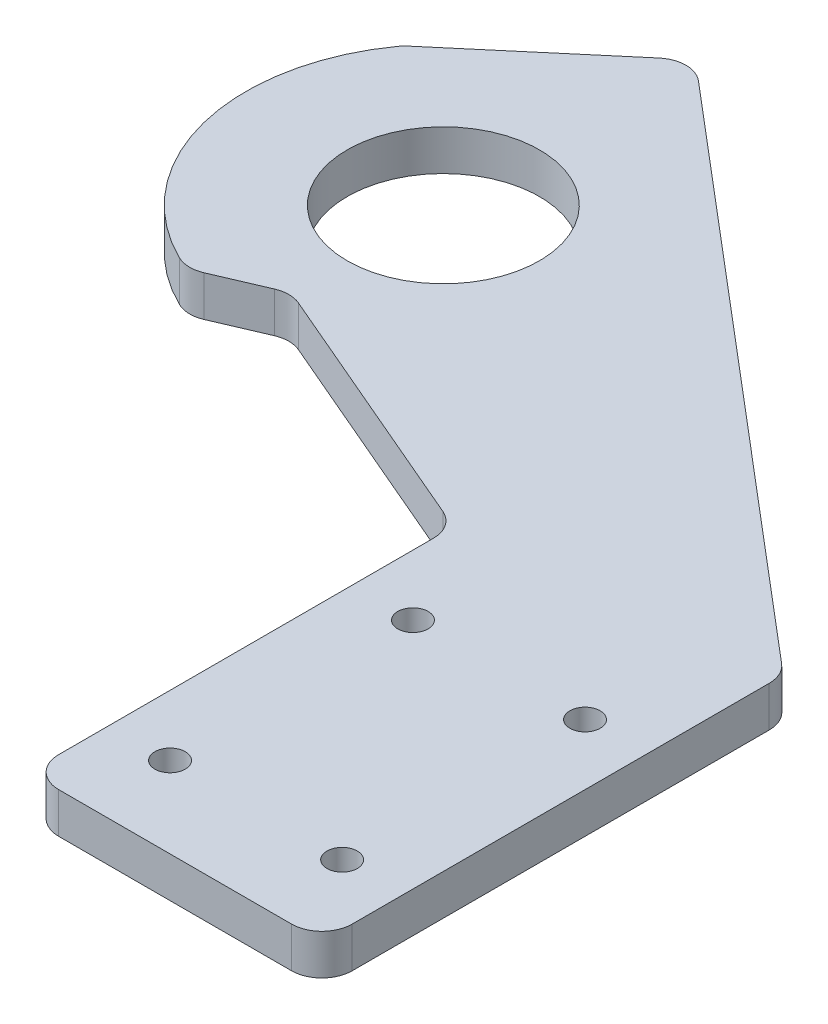
from build123d import *

# Parameters (mm, degrees)
SKETCH_2_R          = 1.5
SKETCH_2_R_2        = 9.5
EXTRUDE_1_DEPTH     = 4
CUT_EXTRUDE_1_DEPTH = 124.429075185
SKETCH_6_R          = 1.5
EXTRUDE_2_DEPTH     = 4
FILLET_1_R          = 3


with BuildPart() as part:
    # 草图2 → 凸台-拉伸1 (new body)
    with BuildSketch(Plane(origin=(0, 0, 0), x_dir=(1, 0, 0), z_dir=(0, 1, 0))):
        Polygon((0, 0), (0, 60), (40, 93.908128514), (80, 60), (80, 0), (68, 0), (68, 42), (40, 54), (12, 42), (12, 0), align=None)
        with Locations(Location((6, 32, 0), (0, 0, 270))):
            Circle(SKETCH_2_R, mode=Mode.SUBTRACT)
        with Locations(Location((6, 8, 0), (0, 0, 270))):
            Circle(SKETCH_2_R, mode=Mode.SUBTRACT)
        with Locations(Location((40, 69, 0), (0, 0, 270))):
            Circle(SKETCH_2_R_2, mode=Mode.SUBTRACT)
        with Locations(Location((74, 8, 0), (0, 0, 90))):
            Circle(SKETCH_2_R, mode=Mode.SUBTRACT)
        with Locations(Location((74, 32, 0), (0, 0, 90))):
            Circle(SKETCH_2_R, mode=Mode.SUBTRACT)
    extrude(amount=EXTRUDE_1_DEPTH)

    # 草图4 → 切除-拉伸1 (cut, through all)
    with BuildSketch(Plane(origin=(0, 4, 0), x_dir=(1, 0, 0), z_dir=(0, 1, 0))):
        with BuildLine():
            Line((24.36723091, 80.656179931), (0, 60))
            Line((0, 60), (0, 0))
            Line((0, 0), (12, 0))
            Line((12, 0), (12, 42))
            Line((12, 42), (32.756034747, 50.895443463))
            ThreePointArc((32.756034747, 50.895443463), (21.23136653, 63.709593809), (24.36723091, 80.656179931))
        make_face()
    extrude(amount=-CUT_EXTRUDE_1_DEPTH, mode=Mode.SUBTRACT)

    # 草图6 → 凸台-拉伸2 (add)
    with BuildSketch(Plane(origin=(0, 4, 0), x_dir=(1, 0, 0), z_dir=(0, 1, 0))):
        Polygon((97, 45.589045381), (80, 60), (80, 0), (97, 0), align=None)
        with Locations(Location((91, 8, 0), (0, 0, 270))):
            Circle(SKETCH_6_R, mode=Mode.SUBTRACT)
        with Locations(Location((91, 32, 0), (0, 0, 270))):
            Circle(SKETCH_6_R, mode=Mode.SUBTRACT)
    extrude(amount=-EXTRUDE_2_DEPTH)

    # 圆角1
    fillet_1_edges = [part.edges().sort_by_distance(p)[0] for p in [
        (40, 2, -93.908128514),
        (68, 2, 0),
        (68, 2, -42),
        (40, 2, -54),
        (24.36723091, 2, -80.656179931),
        (32.756034747, 2, -50.895443463),
        (97, 2, -45.589045381),
        (97, 2, 0),
    ]]
    fillet(fillet_1_edges, radius=FILLET_1_R)


solid = part.part
